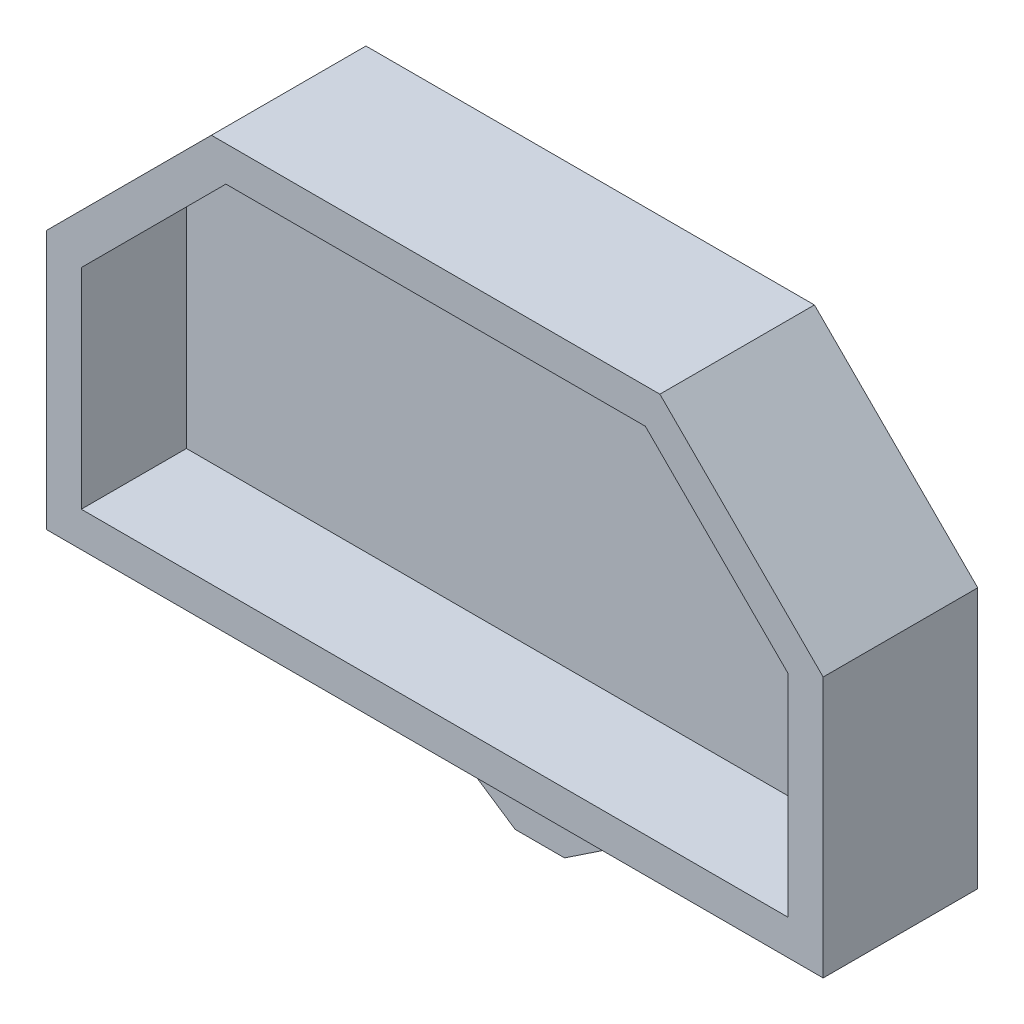
from build123d import *

# Parameters (mm, degrees)
BOSS_EXTRUDE4_DEPTH = 7.62
BOSS_EXTRUDE5_DEPTH = 3.5814
BOSS_EXTRUDE6_DEPTH = 3.5814


with BuildPart() as part:
    # Sketch17 → Boss-Extrude4 (new body)
    with BuildSketch(Plane(origin=(57.616701934, 0, 0), x_dir=(-1, 0, 0), z_dir=(0, 0, -1))):
        Polygon((-9.344833285, -2.54), (-9.344833285, 16.351663206), (2.490045751, 28.186542241), (34.995614796, 28.186542241), (46.962246821, 16.219910216), (46.962246821, -2.54), align=None)
        Polygon((-6.804833285, 0), (-6.804833285, 15.299560757), (3.542148199, 25.646542241), (33.943512348, 25.646542241), (44.422246821, 15.167807768), (44.422246821, 0), align=None, mode=Mode.SUBTRACT)
    extrude(amount=BOSS_EXTRUDE4_DEPTH)

    # Sketch20 → Boss-Extrude5 (add)
    with BuildSketch(Plane(origin=(0, 0, -7.62), x_dir=(-1, 0, 0), z_dir=(0, 0, -1))):
        Polygon((-66.961535219, -2.54), (-66.961535219, 16.351663206), (-55.126656184, 28.186542241), (-22.621087138, 28.186542241), (-10.654455113, 16.219910216), (-10.654455113, -2.54), align=None)
    extrude(amount=BOSS_EXTRUDE5_DEPTH)

    # Sketch21 → Boss-Extrude6 (add)
    with BuildSketch(Plane(origin=(0, 0, -11.2014), x_dir=(-1, 0, 0), z_dir=(0, 0, -1))):
        Polygon((-40.598695166, -6.9149976), (-48.205995166, -6.9149976), (-40.598695166, -11.9949976), (-37.017295166, -11.9949976), (-29.409995166, -6.9149976), (-37.017295166, -6.9149976), (-37.017295166, -2.54), (-40.598695166, -2.54), align=None)
    extrude(amount=-BOSS_EXTRUDE6_DEPTH)


solid = part.part
